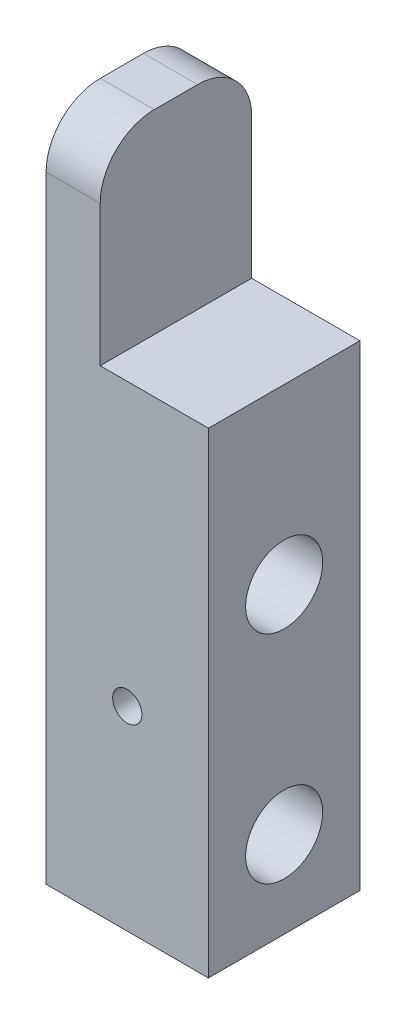
from build123d import *

# Parameters (mm, degrees)
EXTRUDE_1_DEPTH     = 7
SKETCH_3_R          = 3.56
CUT_EXTRUDE_1_DEPTH = 20
SKETCH_4_R          = 1.35
CUT_EXTRUDE_2_DEPTH = 14
FILLET_1_R          = 5


with BuildPart() as part:
    # 草图1 → 凸台-拉伸1 (new, symmetric)
    with BuildSketch(Plane.XY):
        Polygon((-7.5, -18), (7.5, -18), (7.5, 23), (7.5, 26), (-2.5, 26), (-2.5, 44), (-7.5, 44), (-7.5, 26), (-7.5, 21), align=None)
    extrude(amount=EXTRUDE_1_DEPTH, both=True)

    # 草图3 → 切除-拉伸1 (cut)
    with BuildSketch(Plane(origin=(7.5, 0, 0), x_dir=(0, 0, -1), z_dir=(1, 0, 0))):
        with Locations((0, -10)):
            Circle(SKETCH_3_R)
        with Locations((0, 10)):
            Circle(SKETCH_3_R)
    extrude(amount=-CUT_EXTRUDE_1_DEPTH, mode=Mode.SUBTRACT)

    # 草图4 → 切除-拉伸2 (cut)
    with BuildSketch(Plane.XY.offset(7)):
        Circle(SKETCH_4_R)
    extrude(amount=-CUT_EXTRUDE_2_DEPTH, mode=Mode.SUBTRACT)

    # 圆角1
    fillet_1_edges = [part.edges().sort_by_distance(p)[0] for p in [
        (-5, 44, 7),
        (-5, 44, -7),
    ]]
    fillet(fillet_1_edges, radius=FILLET_1_R)


solid = part.part
